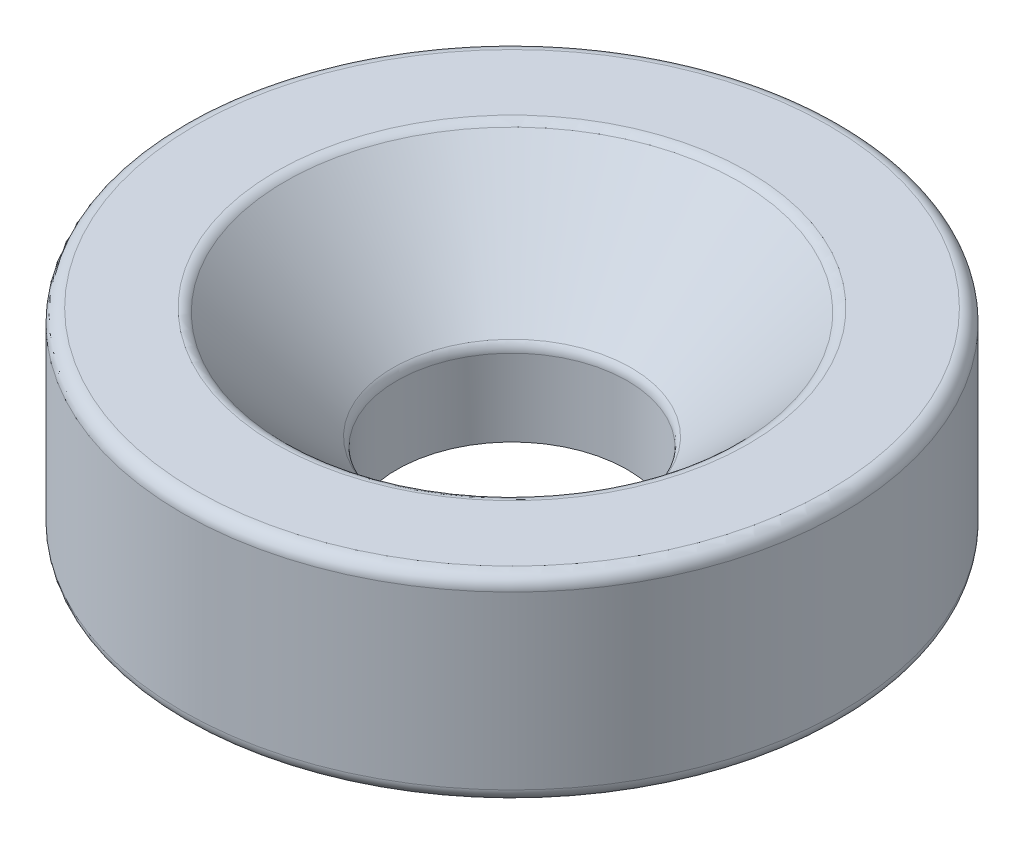
from build123d import *

# Parameters (mm, degrees)
SKETCH_1_R      = 5
SKETCH_1_R_2    = 1.75
EXTRUDE_1_DEPTH = 3
CHAMFER_1_SIZE  = 1.75
FILLET_1_R      = 0.2


with BuildPart() as part:
    # Эскиз1 → Бобышка-Вытянуть1 (new body)
    with BuildSketch(Plane(origin=(0, 0, 0), x_dir=(1, 0, 0), z_dir=(0, 1, 0))):
        with Locations(Location((0, 0, 0), (0, 0, 270))):
            Circle(SKETCH_1_R)
        with Locations(Location((0, 0, 0), (0, 0, 270))):
            Circle(SKETCH_1_R_2, mode=Mode.SUBTRACT)
    extrude(amount=EXTRUDE_1_DEPTH)

    # Фаска1
    chamfer_1_edges = [part.edges().sort_by_distance(p)[0] for p in [
        (0, 3, -1.75),
    ]]
    chamfer(chamfer_1_edges, length=CHAMFER_1_SIZE)

    # Скругление1
    fillet_1_edges = [part.edges().sort_by_distance(p)[0] for p in [
        (0, 3, -3.5),
        (0, 0, -5),
        (0, 3, -5),
        (0, 1.25, -1.75),
    ]]
    fillet(fillet_1_edges, radius=FILLET_1_R)


solid = part.part
